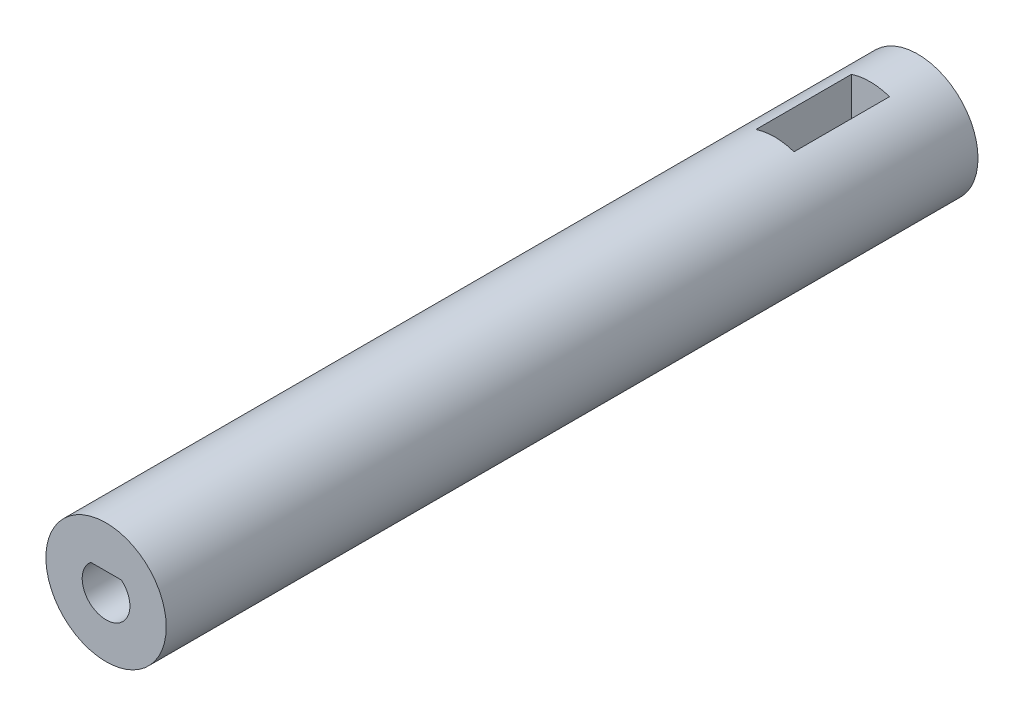
from build123d import *

# Parameters (mm, degrees)
BOSS_EXTRUDE1_DEPTH      = 80
BOSS_EXTRUDE1_DEPTH_BACK = 5
SKETCH1_R                = 6.3
CUT_EXTRUDE1_DEPTH       = 10
CUT_EXTRUDE3_DEPTH       = 17


with BuildPart() as part:
    # Sketch1 → Boss-Extrude1 (new, two sides: drawn at the far end of the back side and taken through both)
    with BuildSketch(Plane.XY.offset(-BOSS_EXTRUDE1_DEPTH_BACK)):
        Circle(SKETCH1_R)
    extrude(amount=BOSS_EXTRUDE1_DEPTH + BOSS_EXTRUDE1_DEPTH_BACK)

    # Sketch6 → Cut-Extrude1 (cut)
    with BuildSketch(Plane(origin=(0, 0, 0), x_dir=(1, 0, 0), z_dir=(0, 1, 0))):
        Polygon((0, 0), (-1.955160092, 0), (-1.955160092, -10), (2.038358394, -10), (2.038358394, 0), align=None)
    extrude(amount=CUT_EXTRUDE1_DEPTH, mode=Mode.SUBTRACT)

    # Sketch7 → Cut-Extrude3 (cut)
    with BuildSketch(Plane.XY.offset(80)):
        with BuildLine():
            Line((1.60670282, 1.915334448), (0, 1.915334448))
            Line((0, 1.915334448), (-1.60670282, 1.915334448))
            ThreePointArc((-1.60670282, 1.915334448), (-1.056703116, -2.265696035), (2.5, 0))
            ThreePointArc((2.5, 0), (2.265696035, 1.056703116), (1.60670282, 1.915334448))
        make_face()
    extrude(amount=-CUT_EXTRUDE3_DEPTH, mode=Mode.SUBTRACT)


solid = part.part
